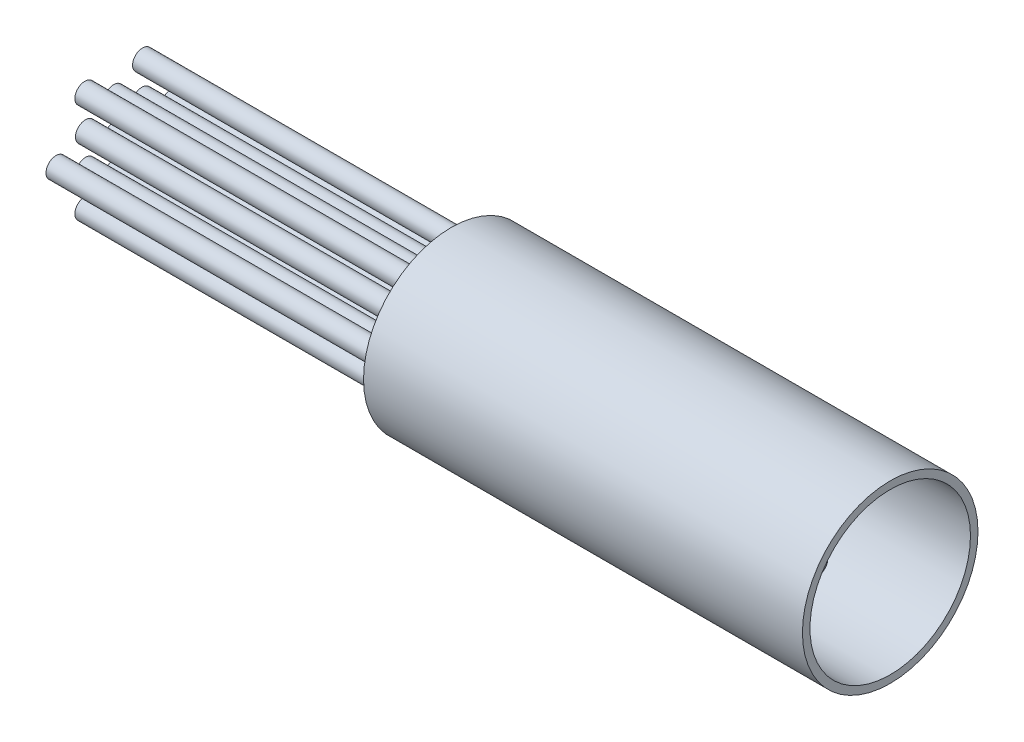
from build123d import *

# Parameters (mm, degrees)
SKETCH1_R                  = 35
SKETCH1_R_2                = 32
BOSS_EXTRUDE2_DEPTH        = 175
BOSS_EXTRUDE3_DEPTH        = 134.6
BOSS_EXTRUDE3_DEPTH_BACK   = 134.6
SKETCH5_R                  = 4
SKETCH5_R_2                = 3
BOSS_EXTRUDE4_DEPTH        = 134.6
BOSS_EXTRUDE4_DEPTH_BACK   = 134.6
SKETCH7_R                  = 4
SKETCH7_R_2                = 3
BOSS_EXTRUDE4_2_DEPTH      = 134.6
BOSS_EXTRUDE4_2_DEPTH_BACK = 134.6
BOSS_EXTRUDE4_3_DEPTH      = 134.6
BOSS_EXTRUDE4_3_DEPTH_BACK = 134.6
BOSS_EXTRUDE4_4_DEPTH      = 134.6
BOSS_EXTRUDE4_4_DEPTH_BACK = 134.6
BOSS_EXTRUDE4_5_DEPTH      = 134.6
BOSS_EXTRUDE4_5_DEPTH_BACK = 134.6
BOSS_EXTRUDE4_6_DEPTH      = 134.6
BOSS_EXTRUDE4_6_DEPTH_BACK = 134.6
BOSS_EXTRUDE5_DEPTH        = 134.6
BOSS_EXTRUDE5_DEPTH_BACK   = 134.6
SKETCH9_R                  = 4
SKETCH9_R_2                = 3
BOSS_EXTRUDE5_2_DEPTH      = 134.6
BOSS_EXTRUDE5_2_DEPTH_BACK = 134.6
BOSS_EXTRUDE5_3_DEPTH      = 134.6
BOSS_EXTRUDE5_3_DEPTH_BACK = 134.6
BOSS_EXTRUDE5_4_DEPTH      = 134.6
BOSS_EXTRUDE5_4_DEPTH_BACK = 134.6
BOSS_EXTRUDE5_5_DEPTH      = 134.6
BOSS_EXTRUDE5_5_DEPTH_BACK = 134.6
BOSS_EXTRUDE5_6_DEPTH      = 134.6
BOSS_EXTRUDE5_6_DEPTH_BACK = 134.6


with BuildPart() as part:
    # Sketch1 → Boss-Extrude2 (new body)
    with BuildSketch(Plane(origin=(0, 0, 0), x_dir=(0, 0, -1), z_dir=(1, 0, 0))):
        Circle(SKETCH1_R)
        Circle(SKETCH1_R_2, mode=Mode.SUBTRACT)
    extrude(amount=BOSS_EXTRUDE2_DEPTH)


with BuildPart() as body_2:
    # Sketch5 → Boss-Extrude3 (new, two sides: drawn at the far end of the back side and taken through both)
    with BuildSketch(Plane.ZY.offset(-BOSS_EXTRUDE3_DEPTH_BACK)):
        Circle(SKETCH5_R)
        Circle(SKETCH5_R_2, mode=Mode.SUBTRACT)
    extrude(amount=BOSS_EXTRUDE3_DEPTH + BOSS_EXTRUDE3_DEPTH_BACK)


with BuildPart() as body_3:
    # Sketch7 → Boss-Extrude4 (new, two sides: drawn at the far end of the back side and taken through both)
    with BuildSketch(Plane.ZY.offset(-BOSS_EXTRUDE4_DEPTH_BACK)):
        with Locations((0, 13)):
            Circle(SKETCH7_R)
        with Locations((0, 13)):
            Circle(SKETCH7_R_2, mode=Mode.SUBTRACT)
    extrude(amount=BOSS_EXTRUDE4_DEPTH + BOSS_EXTRUDE4_DEPTH_BACK)


with BuildPart() as body_4:
    # Sketch7 → Boss-Extrude4 2 (new, two sides: drawn at the far end of the back side and taken through both)
    with BuildSketch(Plane.ZY.offset(-BOSS_EXTRUDE4_2_DEPTH_BACK)):
        with Locations((11.258330249, 6.5)):
            Circle(SKETCH7_R)
        with Locations((11.258330249, 6.5)):
            Circle(SKETCH7_R_2, mode=Mode.SUBTRACT)
    extrude(amount=BOSS_EXTRUDE4_2_DEPTH + BOSS_EXTRUDE4_2_DEPTH_BACK)


with BuildPart() as body_5:
    # Sketch7 → Boss-Extrude4 3 (new, two sides: drawn at the far end of the back side and taken through both)
    with BuildSketch(Plane.ZY.offset(-BOSS_EXTRUDE4_3_DEPTH_BACK)):
        with Locations((11.258330249, -6.5)):
            Circle(SKETCH7_R)
        with Locations((11.258330249, -6.5)):
            Circle(SKETCH7_R_2, mode=Mode.SUBTRACT)
    extrude(amount=BOSS_EXTRUDE4_3_DEPTH + BOSS_EXTRUDE4_3_DEPTH_BACK)


with BuildPart() as body_6:
    # Sketch7 → Boss-Extrude4 4 (new, two sides: drawn at the far end of the back side and taken through both)
    with BuildSketch(Plane.ZY.offset(-BOSS_EXTRUDE4_4_DEPTH_BACK)):
        with Locations((0, -13)):
            Circle(SKETCH7_R)
        with Locations((0, -13)):
            Circle(SKETCH7_R_2, mode=Mode.SUBTRACT)
    extrude(amount=BOSS_EXTRUDE4_4_DEPTH + BOSS_EXTRUDE4_4_DEPTH_BACK)


with BuildPart() as body_7:
    # Sketch7 → Boss-Extrude4 5 (new, two sides: drawn at the far end of the back side and taken through both)
    with BuildSketch(Plane.ZY.offset(-BOSS_EXTRUDE4_5_DEPTH_BACK)):
        with Locations((-11.258330249, -6.5)):
            Circle(SKETCH7_R)
        with Locations((-11.258330249, -6.5)):
            Circle(SKETCH7_R_2, mode=Mode.SUBTRACT)
    extrude(amount=BOSS_EXTRUDE4_5_DEPTH + BOSS_EXTRUDE4_5_DEPTH_BACK)


with BuildPart() as body_8:
    # Sketch7 → Boss-Extrude4 6 (new, two sides: drawn at the far end of the back side and taken through both)
    with BuildSketch(Plane.ZY.offset(-BOSS_EXTRUDE4_6_DEPTH_BACK)):
        with Locations((-11.258330249, 6.5)):
            Circle(SKETCH7_R)
        with Locations((-11.258330249, 6.5)):
            Circle(SKETCH7_R_2, mode=Mode.SUBTRACT)
    extrude(amount=BOSS_EXTRUDE4_6_DEPTH + BOSS_EXTRUDE4_6_DEPTH_BACK)


with BuildPart() as body_9:
    # Sketch9 → Boss-Extrude5 (new, two sides: drawn at the far end of the back side and taken through both)
    with BuildSketch(Plane.ZY.offset(-BOSS_EXTRUDE5_DEPTH_BACK)):
        with Locations((11.5, 19.918584287)):
            Circle(SKETCH9_R)
        with Locations((11.5, 19.918584287)):
            Circle(SKETCH9_R_2, mode=Mode.SUBTRACT)
    extrude(amount=BOSS_EXTRUDE5_DEPTH + BOSS_EXTRUDE5_DEPTH_BACK)


with BuildPart() as body_10:
    # Sketch9 → Boss-Extrude5 2 (new, two sides: drawn at the far end of the back side and taken through both)
    with BuildSketch(Plane.ZY.offset(-BOSS_EXTRUDE5_2_DEPTH_BACK)):
        with Locations((23, 0)):
            Circle(SKETCH9_R)
        with Locations((23, 0)):
            Circle(SKETCH9_R_2, mode=Mode.SUBTRACT)
    extrude(amount=BOSS_EXTRUDE5_2_DEPTH + BOSS_EXTRUDE5_2_DEPTH_BACK)


with BuildPart() as body_11:
    # Sketch9 → Boss-Extrude5 3 (new, two sides: drawn at the far end of the back side and taken through both)
    with BuildSketch(Plane.ZY.offset(-BOSS_EXTRUDE5_3_DEPTH_BACK)):
        with Locations((11.5, -19.918584287)):
            Circle(SKETCH9_R)
        with Locations((11.5, -19.918584287)):
            Circle(SKETCH9_R_2, mode=Mode.SUBTRACT)
    extrude(amount=BOSS_EXTRUDE5_3_DEPTH + BOSS_EXTRUDE5_3_DEPTH_BACK)


with BuildPart() as body_12:
    # Sketch9 → Boss-Extrude5 4 (new, two sides: drawn at the far end of the back side and taken through both)
    with BuildSketch(Plane.ZY.offset(-BOSS_EXTRUDE5_4_DEPTH_BACK)):
        with Locations((-11.5, -19.918584287)):
            Circle(SKETCH9_R)
        with Locations((-11.5, -19.918584287)):
            Circle(SKETCH9_R_2, mode=Mode.SUBTRACT)
    extrude(amount=BOSS_EXTRUDE5_4_DEPTH + BOSS_EXTRUDE5_4_DEPTH_BACK)


with BuildPart() as body_13:
    # Sketch9 → Boss-Extrude5 5 (new, two sides: drawn at the far end of the back side and taken through both)
    with BuildSketch(Plane.ZY.offset(-BOSS_EXTRUDE5_5_DEPTH_BACK)):
        with Locations((-23, 0)):
            Circle(SKETCH9_R)
        with Locations((-23, 0)):
            Circle(SKETCH9_R_2, mode=Mode.SUBTRACT)
    extrude(amount=BOSS_EXTRUDE5_5_DEPTH + BOSS_EXTRUDE5_5_DEPTH_BACK)


with BuildPart() as body_14:
    # Sketch9 → Boss-Extrude5 6 (new, two sides: drawn at the far end of the back side and taken through both)
    with BuildSketch(Plane.ZY.offset(-BOSS_EXTRUDE5_6_DEPTH_BACK)):
        with Locations((-11.5, 19.918584287)):
            Circle(SKETCH9_R)
        with Locations((-11.5, 19.918584287)):
            Circle(SKETCH9_R_2, mode=Mode.SUBTRACT)
    extrude(amount=BOSS_EXTRUDE5_6_DEPTH + BOSS_EXTRUDE5_6_DEPTH_BACK)


solid = Compound([part.part, body_2.part, body_3.part, body_4.part, body_5.part, body_6.part, body_7.part, body_8.part, body_9.part, body_10.part, body_11.part, body_12.part, body_13.part, body_14.part])
